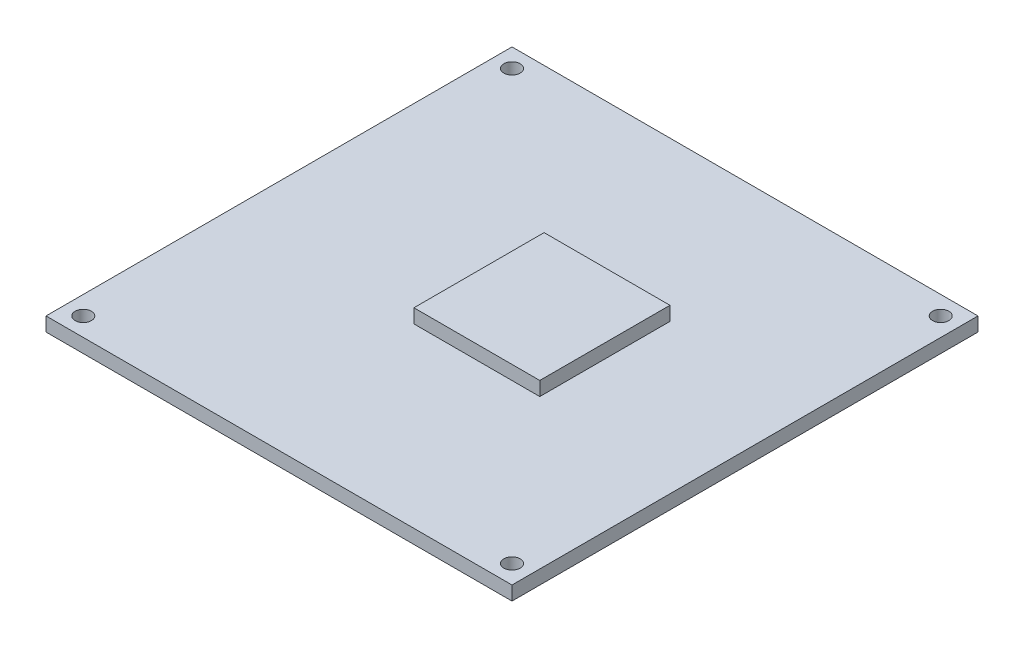
from build123d import *

# Parameters (mm, degrees)
SKETCH_1_W      = 100
SKETCH_1_H      = 100
SKETCH_1_R      = 1.75
EXTRUDE_1_DEPTH = 3
SKETCH_2_W      = 27.007096721
SKETCH_2_H      = 27.931561416
EXTRUDE_2_DEPTH = 3


with BuildPart() as part:
    # 草图1 → 凸台-拉伸1 (new body)
    with BuildSketch(Plane(origin=(0, 0, 0), x_dir=(1, 0, 0), z_dir=(0, 1, 0))):
        Rectangle(SKETCH_1_W, SKETCH_1_H)
        with Locations(Location((46, 46, 0), (0, 0, 270))):
            Circle(SKETCH_1_R, mode=Mode.SUBTRACT)
        with Locations(Location((46, -46, 0), (0, 0, 90))):
            Circle(SKETCH_1_R, mode=Mode.SUBTRACT)
        with Locations(Location((-46, -46, 0), (0, 0, 270))):
            Circle(SKETCH_1_R, mode=Mode.SUBTRACT)
        with Locations(Location((-46, 46, 0), (0, 0, 90))):
            Circle(SKETCH_1_R, mode=Mode.SUBTRACT)
    extrude(amount=EXTRUDE_1_DEPTH)

    # 草图2 → 凸台-拉伸2 (add)
    with BuildSketch(Plane(origin=(0, 3, 0), x_dir=(1, 0, 0), z_dir=(0, 1, 0))):
        with Locations((4.463708772, 1.960757277)):
            Rectangle(SKETCH_2_W, SKETCH_2_H)
    extrude(amount=EXTRUDE_2_DEPTH)


solid = part.part
